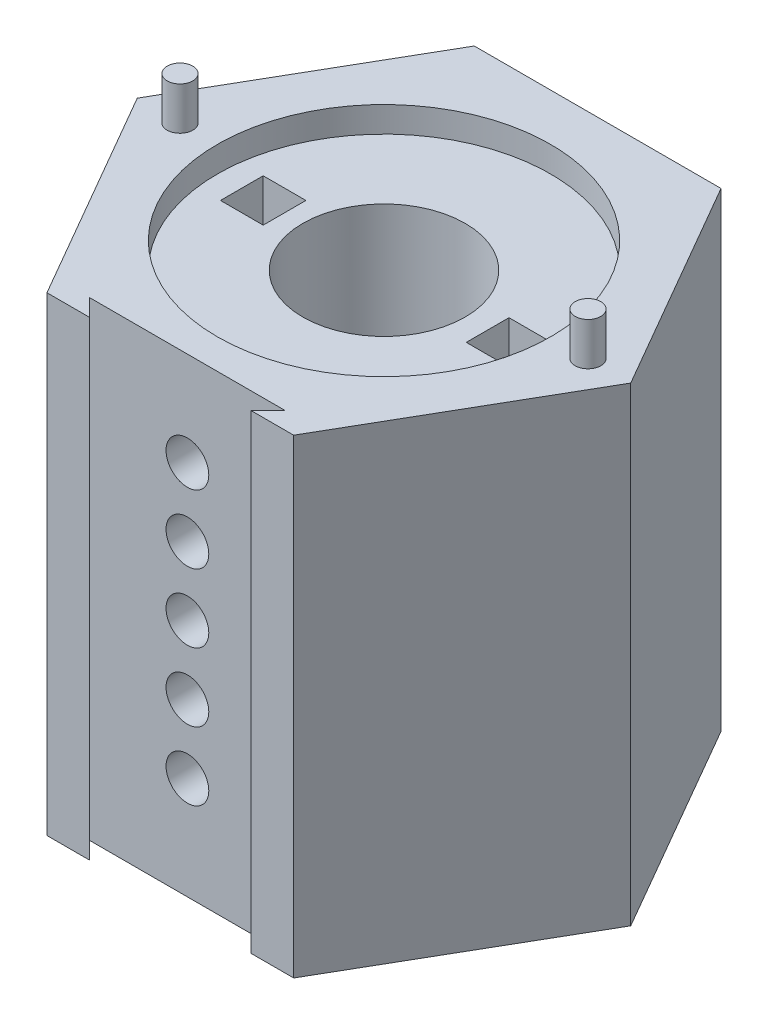
from build123d import *

# Parameters (mm, degrees)
BOSS_EXTRUDE1_DEPTH = 55
SKETCH2_R           = 9.5
CUT_EXTRUDE1_DEPTH  = 60
SKETCH3_R           = 19.5
CUT_EXTRUDE2_DEPTH  = 3
SKETCH4_R           = 2.5
CUT_EXTRUDE3_DEPTH  = 23
SKETCH5_W           = 5
SKETCH5_H           = 5
CUT_EXTRUDE4_DEPTH  = 5
CUT_EXTRUDE5_DEPTH  = 60
SKETCH7_R           = 1.5
BOSS_EXTRUDE2_DEPTH = 5


with BuildPart() as part:
    # Sketch1 → Boss-Extrude1 (new body)
    with BuildSketch(Plane(origin=(0, 0, 0), x_dir=(1, 0, 0), z_dir=(0, 1, 0))):
        Polygon((-28.867513459, 0), (-14.43375673, -25), (14.43375673, -25), (28.867513459, 0), (14.43375673, 25), (-14.43375673, 25), align=None)
    extrude(amount=BOSS_EXTRUDE1_DEPTH)

    # Sketch2 → Cut-Extrude1 (cut)
    with BuildSketch(Plane.XZ):
        with Locations(Location((0, 0, 0), (0, 0, 270))):
            Circle(SKETCH2_R)
    extrude(amount=-CUT_EXTRUDE1_DEPTH, mode=Mode.SUBTRACT)

    # Sketch3 → Cut-Extrude2 (cut)
    with BuildSketch(Plane(origin=(0, 55, 0), x_dir=(1, 0, 0), z_dir=(0, 1, 0))):
        with Locations(Location((0, 0, 0), (0, 0, 270))):
            Circle(SKETCH3_R)
    extrude(amount=-CUT_EXTRUDE2_DEPTH, mode=Mode.SUBTRACT)

    # Sketch4 → Cut-Extrude3 (cut)
    with BuildSketch(Plane.XY.offset(25)):
        with Locations((0, 12)):
            Circle(SKETCH4_R)
        with Locations((0, 20)):
            Circle(SKETCH4_R)
        with Locations((0, 28)):
            Circle(SKETCH4_R)
        with Locations((0, 36)):
            Circle(SKETCH4_R)
        with Locations((0, 44)):
            Circle(SKETCH4_R)
    extrude(amount=-CUT_EXTRUDE3_DEPTH, mode=Mode.SUBTRACT)

    # Sketch5 → Cut-Extrude4 (cut)
    with BuildSketch(Plane(origin=(0, 52, 0), x_dir=(1, 0, 0), z_dir=(0, 1, 0))):
        with Locations((-14.134558147, 0)):
            Rectangle(SKETCH5_W, SKETCH5_H)
        with Locations((14.623643585, 0)):
            Rectangle(SKETCH5_W, SKETCH5_H)
    extrude(amount=-CUT_EXTRUDE4_DEPTH, mode=Mode.SUBTRACT)

    # Sketch6 → Cut-Extrude5 (cut)
    with BuildSketch(Plane.XZ):
        Polygon((9.43375673, 25), (-9.43375673, 25), (-11.43375673, 23), (-9.43375673, 23), (9.43375673, 23), (11.43375673, 23), align=None)
    extrude(amount=-CUT_EXTRUDE5_DEPTH, mode=Mode.SUBTRACT)

    # Sketch7 → Boss-Extrude2 (add)
    with BuildSketch(Plane(origin=(0, 55, 0), x_dir=(1, 0, 0), z_dir=(0, 1, 0))):
        with Locations(Location((23.867513459, 0, 0), (0, 0, 270))):
            Circle(SKETCH7_R)
        with Locations(Location((-23.867513459, 0, 0), (0, 0, 270))):
            Circle(SKETCH7_R)
    extrude(amount=BOSS_EXTRUDE2_DEPTH)


solid = part.part
